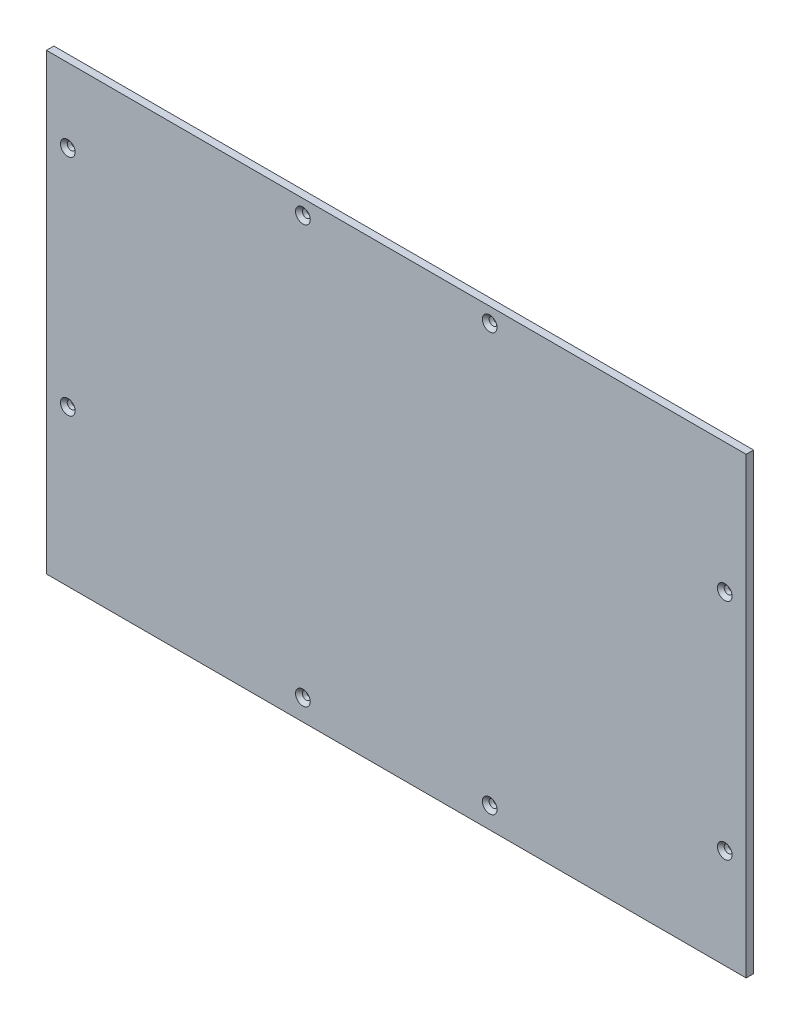
from build123d import *

# Parameters (mm, degrees)
SKETCH1_W                                       = 299.7
SKETCH1_H                                       = 194.25
SKETCH1_R                                       = 10.775
BOSS_EXTRUDE1_DEPTH                             = 3.175
CSK_FOR_M3_FLAT_HEAD_MACHINE_SCREW1_D           = 3.4
CSK_FOR_M3_FLAT_HEAD_MACHINE_SCREW1_CSINK_D     = 6.3
CSK_FOR_M3_FLAT_HEAD_MACHINE_SCREW1_CSINK_ANGLE = 90


with BuildPart() as part:
    # Sketch1 → Boss-Extrude1 (new body)
    # profile 1 of 5: a face of its own
    with BuildSketch(Plane.XY):
        Rectangle(SKETCH1_W, SKETCH1_H)
        with Locations((-139.075, -86.35)):
            Circle(SKETCH1_R, mode=Mode.SUBTRACT)
        with Locations((-127.075, -63.35)):
            Circle(SKETCH1_R, mode=Mode.SUBTRACT)
    # profile 2 of 5: a face of its own
    with BuildSketch(Plane.XY):
        with Locations((-127.075, -63.35)):
            Circle(SKETCH1_R)
    # profile 3 of 5: a face of its own
    with BuildSketch(Plane.XY):
        with Locations((-139.075, -86.35)):
            Circle(SKETCH1_R)
    # profile 4 of 5: a face of its own
    with BuildSketch(Plane.XY):
        with BuildLine():
            ThreePointArc((-139.075, -97.125), (-146.694075567, -93.969075567), (-149.85, -86.35))
            Line((-149.85, -86.35), (-149.85, -97.125))
            Line((-149.85, -97.125), (-139.075, -97.125))
        make_face()
    # profile 5 of 5: a face of its own
    with BuildSketch(Plane.XY):
        Rectangle(SKETCH1_W, SKETCH1_H)
    extrude(amount=BOSS_EXTRUDE1_DEPTH)

    # CSK for M3 Flat Head Machine Screw1 (through all)
    with Locations(Plane.XY.offset(3.175)):
        with Locations((-40, 90.775000052), (140.687500033, 41.475000052), (140.687500033, -54.524999948), (40, -88.030749948), (-40, -88.030749948), (-140.687500033, -30.524999948), (-140.687500033, 65.475000052), (40, 90.775000052)):
            CounterSinkHole(CSK_FOR_M3_FLAT_HEAD_MACHINE_SCREW1_D / 2, CSK_FOR_M3_FLAT_HEAD_MACHINE_SCREW1_CSINK_D / 2, counter_sink_angle=CSK_FOR_M3_FLAT_HEAD_MACHINE_SCREW1_CSINK_ANGLE)


solid = part.part
